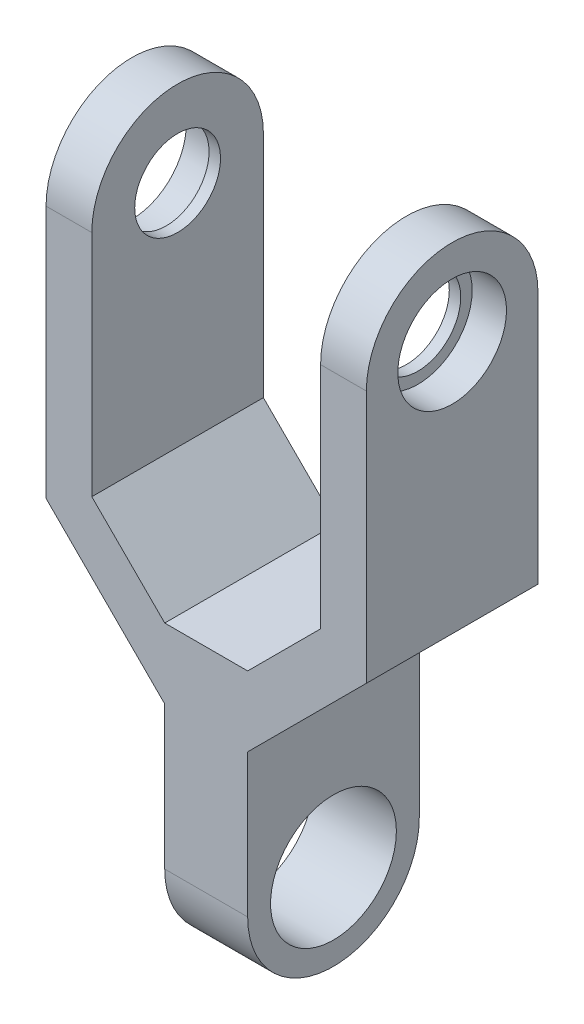
from build123d import *

# Parameters (mm, degrees)
EXTRUDE_1_DEPTH     = 30
CUT_EXTRUDE_1_DEPTH = 102.205545797
EXTRUDE_2_DEPTH     = 14.5
SKETCH_4_R          = 11
CUT_EXTRUDE_2_DEPTH = 20
EXTRUDE_3_DEPTH     = 8
EXTRUDE_START       = -8
EXTRUDE_4_DEPTH     = 8
SKETCH_9_R          = 7.5
CUT_EXTRUDE_5_DEPTH = 62
SKETCH_10_R         = 9.5
CUT_EXTRUDE_6_DEPTH = 6
CUT_EXTRUDE_START   = -6
SKETCH_11_R         = 9.5
CUT_EXTRUDE_7_DEPTH = 6


with BuildPart() as part:
    # 草图1 → 凸台-拉伸1 (new body)
    with BuildSketch(Plane.XY):
        Polygon((0, 0), (14.5, 0), (14.5, 25), (35.25, 45.75), (35.25, 90), (27.25, 90), (27.25, 50), (-12.75, 50), (-12.75, 90), (-20.75, 90), (-20.75, 45.75), (0, 25), align=None)
    extrude(amount=EXTRUDE_1_DEPTH)

    # 草图2 → 切除-拉伸1 (cut, through all)
    with BuildSketch(Plane.XY.offset(30)):
        Polygon((-12.75, 50), (0, 37.25), (14.5, 37.25), (27.25, 50), align=None)
    extrude(amount=-CUT_EXTRUDE_1_DEPTH, mode=Mode.SUBTRACT)

    # 草图3 → 凸台-拉伸2 (add)
    with BuildSketch(Plane(origin=(14.5, 0, 0), x_dir=(0, 0, -1), z_dir=(1, 0, 0))):
        with BuildLine():
            Line((-30, 0), (0, 0))
            ThreePointArc((0, 0), (-15, -15), (-30, 0))
        make_face()
    extrude(amount=-EXTRUDE_2_DEPTH)

    # 草图4 → 切除-拉伸2 (cut)
    with BuildSketch(Plane(origin=(14.5, 0, 0), x_dir=(0, 0, -1), z_dir=(1, 0, 0))):
        with Locations((-15, 0)):
            Circle(SKETCH_4_R)
    extrude(amount=-CUT_EXTRUDE_2_DEPTH, mode=Mode.SUBTRACT)

    # 草图7 → 凸台-拉伸3 (add)
    with BuildSketch(Plane(origin=(35.25, 0, 0), x_dir=(0, 0, -1), z_dir=(1, 0, 0))):
        with BuildLine():
            Line((-30, 90), (0, 90))
            ThreePointArc((0, 90), (-15, 105), (-30, 90))
        make_face()
    extrude(amount=-EXTRUDE_3_DEPTH)

    # 草图8 → 凸台-拉伸4 (add)
    with BuildSketch(Plane.ZY.offset(20.75).offset(EXTRUDE_START)):
        with BuildLine():
            Line((0, 90), (30, 90))
            ThreePointArc((30, 90), (15, 105), (0, 90))
        make_face()
    extrude(amount=EXTRUDE_4_DEPTH)

    # 草图9 → 切除-拉伸5 (cut)
    with BuildSketch(Plane.ZY.offset(20.75)):
        with Locations(Location((15, 90, 0), (0, 0, 270))):
            Circle(SKETCH_9_R)
    extrude(amount=-CUT_EXTRUDE_5_DEPTH, mode=Mode.SUBTRACT)

    # 草图10 → 切除-拉伸6 (cut)
    with BuildSketch(Plane.ZY.offset(20.75)):
        with Locations(Location((15, 90, 0), (0, 0, 270))):
            Circle(SKETCH_10_R)
    extrude(amount=-CUT_EXTRUDE_6_DEPTH, mode=Mode.SUBTRACT)

    # 草图11 → 切除-拉伸7 (cut)
    with BuildSketch(Plane(origin=(35.25, 0, 0), x_dir=(0, 0, -1), z_dir=(1, 0, 0)).offset(CUT_EXTRUDE_START)):
        with Locations(Location((-15, 90, 0), (0, 0, 270))):
            Circle(SKETCH_11_R)
    extrude(amount=CUT_EXTRUDE_7_DEPTH, mode=Mode.SUBTRACT)


solid = part.part
